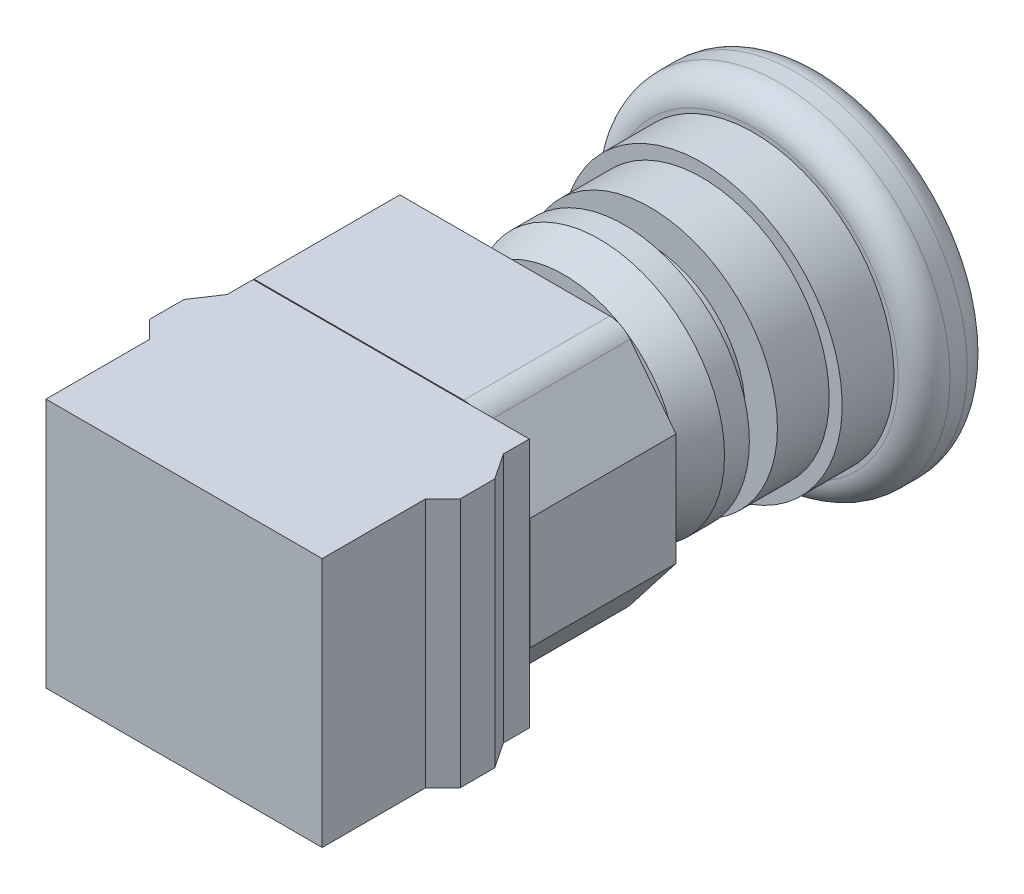
from build123d import *

# Parameters (mm, degrees)
SKETCH_1_W          = 32
SKETCH_1_H          = 29
EXTRUDE_1_DEPTH     = 12
EXTRUDE_2_DEPTH     = 29
SKETCH_3_R          = 11
EXTRUDE_3_DEPTH     = 17
SKETCH_4_R          = 11
EXTRUDE_4_DEPTH     = 3
SKETCH_5_R          = 14.5
EXTRUDE_6_DEPTH     = 10
SKETCH_6_R          = 14.75
EXTRUDE_7_DEPTH     = 6
SKETCH_7_R          = 16.25
EXTRUDE_8_DEPTH     = 6
SKETCH_8_R          = 19.75
EXTRUDE_9_DEPTH     = 8
CUT_EXTRUDE_START   = 3
SKETCH_9_R          = 22.553802592
SKETCH_9_R_2        = 11
CUT_EXTRUDE_1_DEPTH = 3
CHAMFER_1_SIZE      = 1.5
CHAMFER_1_SIZE2     = 4.121216129
FILLET_1_R          = 3
FILLET_2_R          = 3
CUT_EXTRUDE_START_2 = 0.1
CUT_EXTRUDE_2_DEPTH = 0.1
CUT_EXTRUDE_3_DEPTH = 0.3


with BuildPart() as part:
    # 草图1 → 凸台-拉伸1 (new body)
    with BuildSketch(Plane.XY):
        with Locations((16, -14.5)):
            Rectangle(SKETCH_1_W, SKETCH_1_H)
    extrude(amount=EXTRUDE_1_DEPTH)

    # 草图2 → 凸台-拉伸2 (add)
    with BuildSketch(Plane(origin=(0, 0, 0), x_dir=(1, 0, 0), z_dir=(0, 1, 0))):
        Polygon((0, 0), (-2, 2), (-2, 6), (0, 9), (0, 12), (29.3, 12), (32, 12), (32, 9), (34, 6), (34, 2), (32, 0), align=None)
    extrude(amount=-EXTRUDE_2_DEPTH)

    # 草图3 → 凸台-拉伸3 (add)
    with BuildSketch(Plane(origin=(0, 0, -12), x_dir=(-1, 0, 0), z_dir=(0, 0, -1))):
        Polygon((0, 0), (-25.777777778, 0), (-32, -8), (-32, -21), (-25.777777778, -29), (0, -29), align=None)
        with Locations((-16, -14.5)):
            Circle(SKETCH_3_R, mode=Mode.SUBTRACT)
    extrude(amount=EXTRUDE_3_DEPTH)

    # 圆角2
    fillet_2_edges = [part.edges().sort_by_distance(p)[0] for p in [
        (25.777777778, 0, -20.5),
        (25.777777778, -29, -20.5),
    ]]
    fillet(fillet_2_edges, radius=FILLET_2_R)

    # 草图10 → 切除-拉伸2 (cut)
    with BuildSketch(Plane(origin=(0, 0, -12), x_dir=(-1, 0, 0), z_dir=(0, 0, -1)).offset(CUT_EXTRUDE_START_2)):
        with BuildLine():
            Line((-32, -8), (-32, -21))
            Line((-32, -21), (-26.678583013, -27.841821841))
            ThreePointArc((-26.678583013, -27.841821841), (-25.628580699, -28.694945781), (-24.310526361, -29))
            Line((-24.310526361, -29), (0, -29))
            Line((0, -29), (0, 0))
            Line((0, 0), (-24.310526361, 0))
            ThreePointArc((-24.310526361, 0), (-25.628580699, -0.305054219), (-26.678583013, -1.158178159))
            Line((-26.678583013, -1.158178159), (-32, -8))
        make_face()
        with BuildLine():
            Line((-31.9, -8.034310775), (-31.9, -20.965689225))
            Line((-31.9, -20.965689225), (-26.599647791, -27.780427779))
            ThreePointArc((-26.599647791, -27.780427779), (-25.584645555, -28.605114255), (-24.310526361, -28.9))
            Line((-24.310526361, -28.9), (-0.1, -28.9))
            Line((-0.1, -28.9), (-0.1, -0.1))
            Line((-0.1, -0.1), (-24.310526361, -0.1))
            ThreePointArc((-24.310526361, -0.1), (-25.584645555, -0.394885745), (-26.599647791, -1.219572221))
            Line((-26.599647791, -1.219572221), (-31.9, -8.034310775))
        make_face(mode=Mode.SUBTRACT)
    extrude(amount=-CUT_EXTRUDE_2_DEPTH, mode=Mode.SUBTRACT)


with BuildPart() as body_2:
    # 草图4 → 凸台-拉伸4 (new body)
    with BuildSketch(Plane(origin=(0, 0, -29), x_dir=(-1, 0, 0), z_dir=(0, 0, -1))):
        with Locations((-16, -14.5)):
            Circle(SKETCH_4_R)
    extrude(amount=EXTRUDE_4_DEPTH)

    # 草图5 → 凸台-拉伸6 (add)
    with BuildSketch(Plane(origin=(0, 0, -32), x_dir=(-1, 0, 0), z_dir=(0, 0, -1))):
        with Locations((-16, -14.5)):
            Circle(SKETCH_5_R)
    extrude(amount=EXTRUDE_6_DEPTH)

    # 草图6 → 凸台-拉伸7 (add)
    with BuildSketch(Plane(origin=(0, 0, -42), x_dir=(-1, 0, 0), z_dir=(0, 0, -1))):
        with Locations((-16, -14.5)):
            Circle(SKETCH_6_R)
    extrude(amount=EXTRUDE_7_DEPTH)

    # 草图7 → 凸台-拉伸8 (add)
    with BuildSketch(Plane(origin=(0, 0, -48), x_dir=(-1, 0, 0), z_dir=(0, 0, -1))):
        with Locations((-16, -14.5)):
            Circle(SKETCH_7_R)
    extrude(amount=EXTRUDE_8_DEPTH)

    # 草图8 → 凸台-拉伸9 (add)
    with BuildSketch(Plane(origin=(0, 0, -54), x_dir=(-1, 0, 0), z_dir=(0, 0, -1))):
        with Locations((-16, -14.5)):
            Circle(SKETCH_8_R)
    extrude(amount=EXTRUDE_9_DEPTH)

    # 草图9 → 切除-拉伸1 (cut)
    with BuildSketch(Plane.XY.offset(-42).offset(CUT_EXTRUDE_START)):
        with Locations((16, -14.5)):
            Circle(SKETCH_9_R)
        with Locations((16, -14.5)):
            Circle(SKETCH_9_R_2, mode=Mode.SUBTRACT)
    extrude(amount=-CUT_EXTRUDE_1_DEPTH, mode=Mode.SUBTRACT)

    # 倒角1
    chamfer_1_edges = [body_2.edges().sort_by_distance(p)[0] for p in [
        (30.5, -14.5, -32),
    ]]
    chamfer_1_side = [body_2.faces().sort_by_distance(p)[0] for p in [
        (30.089878067, -14.5, -32),
    ]]
    chamfer(chamfer_1_edges, length=CHAMFER_1_SIZE, length2=CHAMFER_1_SIZE2, reference=chamfer_1_side[0])

    # 圆角1
    fillet_1_edges = [body_2.edges().sort_by_distance(p)[0] for p in [
        (35.75, -14.5, -54),
        (35.75, -14.5, -62),
    ]]
    fillet(fillet_1_edges, radius=FILLET_1_R)

    # 草图11 → 切除-拉伸3 (cut)
    with BuildSketch(Plane(origin=(0, 0, -62), x_dir=(-1, 0, 0), z_dir=(0, 0, -1))):
        Polygon((-5.5, -14.5), (-6.5, -14.5), (-4.25, -17.5), (-2, -14.5), (-3, -14.5), align=None)
        with BuildLine():
            Line((-5.5, -14.5), (-3, -14.5))
            ThreePointArc((-3, -14.5), (-4.741669751, -8), (-9.5, -3.241669751))
            Line((-9.5, -3.241669751), (-10.75, -5.40673326))
            ThreePointArc((-10.75, -5.40673326), (-6.90673326, -9.25), (-5.5, -14.5))
        make_face()
        with BuildLine():
            Line((-21.25, -23.59326674), (-22.5, -25.758330249))
            ThreePointArc((-22.5, -25.758330249), (-16, -27.5), (-9.5, -25.758330249))
            Line((-9.5, -25.758330249), (-10.75, -23.59326674))
            ThreePointArc((-10.75, -23.59326674), (-16, -25), (-21.25, -23.59326674))
        make_face()
        Polygon((-21.25, -23.59326674), (-20.75, -22.727241336), (-24.473076211, -23.175798494), (-23, -26.624355653), (-22.5, -25.758330249), align=None)
        Polygon((-21.25, -5.40673326), (-20.75, -6.272758664), (-19.276923789, -2.824201506), (-23, -2.375644347), (-22.5, -3.241669751), align=None)
        with BuildLine():
            Line((-21.25, -5.40673326), (-22.5, -3.241669751))
            ThreePointArc((-22.5, -3.241669751), (-27.258330249, -8), (-29, -14.5))
            Line((-29, -14.5), (-26.5, -14.5))
            ThreePointArc((-26.5, -14.5), (-25.09326674, -9.25), (-21.25, -5.40673326))
        make_face()
    extrude(amount=-CUT_EXTRUDE_3_DEPTH, mode=Mode.SUBTRACT)


solid = Compound([part.part, body_2.part])
